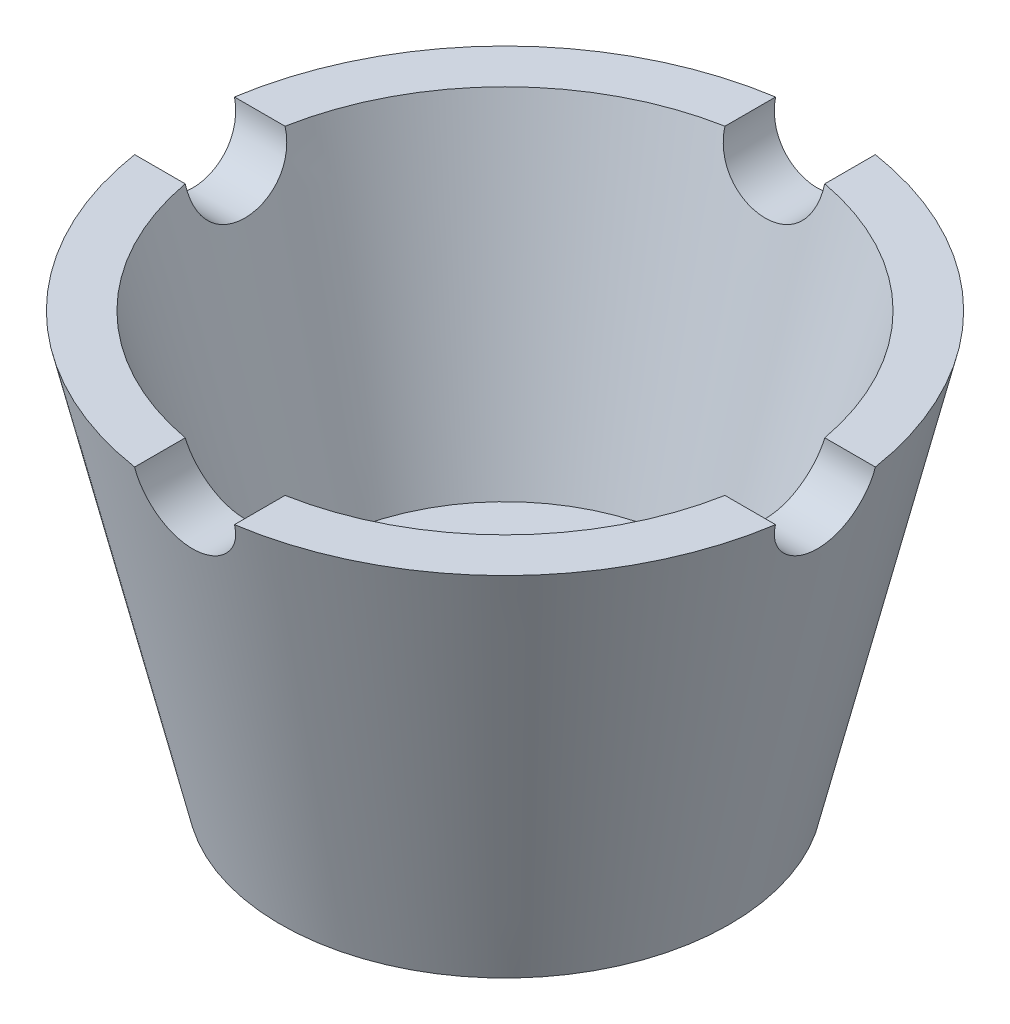
from build123d import *

# Parameters (mm, degrees)
CUT_EXTRUDE1_REACH = 64.262
SKETCH5_R          = 5
CIRPATTERN1_COUNT  = 4


with BuildPart() as part:
    # Sketch4 → Revolve1 (revolve)
    with BuildSketch(Plane.XY, mode=Mode.PRIVATE) as revolve1_sk:
        Polygon((11.25, 0), (11.25, 12), (19, 12), (27.5, 42), (32.5, 42), (22.5, 0), align=None)
    revolve(revolve1_sk.sketch.rotate(Axis((0, 0, 0), (0, 1, 0)), 90), axis=Axis((0, 0, 0), (0, 1, 0)))

    # Cut-Extrude1: up to this cone (the profile starts inside it)
    cut_extrude1_end = Plane(origin=(0, 42, 0), z_dir=(0, 1, 0)) * Cone(9.342380952, 55.657619048, 194.524, mode=Mode.PRIVATE)
    # Sketch5 → Cut-Extrude1 (cut, up to the surface)
    with BuildSketch(Plane.XY, mode=Mode.PRIVATE) as cut_extrude1_sk1:
        with Locations((0, 42)):
            Circle(SKETCH5_R)
    cut_extrude1_tool1 = extrude(cut_extrude1_sk1.sketch, amount=-CUT_EXTRUDE1_REACH, mode=Mode.PRIVATE) & cut_extrude1_end
    cut_extrude1 = cut_extrude1_tool1.solids().sort_by_distance((0, 42, 0))[0]
    add(cut_extrude1, mode=Mode.SUBTRACT)

    # CirPattern1: Cut-Extrude1 ×4 about axis
    cirpattern1_axis = Axis((0, 42, 0), (0, -1, 0))
    for i in range(1, CIRPATTERN1_COUNT):
        add(cut_extrude1.rotate(cirpattern1_axis, i * 360 / CIRPATTERN1_COUNT), mode=Mode.SUBTRACT)


solid = part.part
